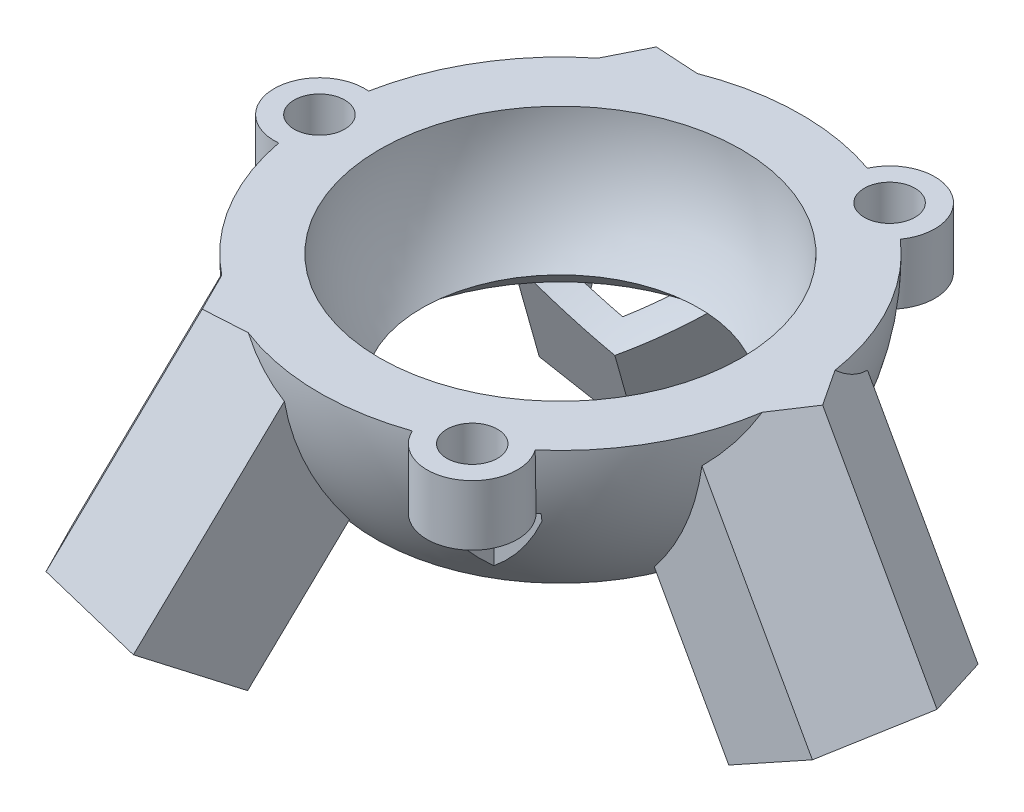
from build123d import *

# Parameters (mm, degrees)
IZIM4_R                          = 3.75
IZIM4_R_2                        = 1.75
Y_KSEKLIK_EKSTR_ZYON1_DEPTH      = 5
IZIM5_R                          = 2.1
KES_EKSTR_ZYON1_DEPTH            = 24
KES_EKSTR_ZYON2_DEPTH            = 36.170331308
Y_KSEKLIK_EKSTR_ZYON2_REACH      = 67.295
Y_KSEKLIK_EKSTR_ZYON2_END_RADIUS = 20
Y_KSEKLIK_EKSTR_ZYON2_START      = -5
DAIRESEL_KAPLAMA1_COUNT          = 3
KES_EKSTR_ZYON3_DEPTH            = 45
KES_EKSTR_ZYON3_DEPTH_BACK       = 39
IZIM10_W                         = 61.268894521
IZIM10_H                         = 17.891205564


with BuildPart() as part:
    # Çizim3 → Döndür1 (revolve)
    with BuildSketch(Plane.XY, mode=Mode.PRIVATE) as d_nd_r1_sk:
        with BuildLine():
            Line((-11.490666647, -9.641814145), (-15.320888862, -12.855752194))
            ThreePointArc((-15.320888862, -12.855752194), (-18.793852416, -6.840402867), (-20, 0))
            Line((-20, 0), (-15, 0))
            ThreePointArc((-15, 0), (-14.095389312, -5.13030215), (-11.490666647, -9.641814145))
        make_face()
    revolve(d_nd_r1_sk.sketch.rotate(Axis((0, 24.311963794, 0), (0, -1, 0)), 270), axis=Axis((0, 24.311963794, 0), (0, -1, 0)))

    # Çizim4 → Yükseklik-Ekstrüzyon1 (add)
    # profile 1 of 3: a face of its own
    with BuildSketch(Plane(origin=(0, 0, 0), x_dir=(1, 0, 0), z_dir=(0, 1, 0))):
        with Locations((10, 17.320508076)):
            Circle(IZIM4_R)
        with Locations((10, 17.320508076)):
            Circle(IZIM4_R_2, mode=Mode.SUBTRACT)
    # profile 2 of 3: a face of its own
    with BuildSketch(Plane(origin=(0, 0, 0), x_dir=(1, 0, 0), z_dir=(0, 1, 0))):
        with Locations((-20, 0)):
            Circle(IZIM4_R)
        with Locations((-20, 0)):
            Circle(IZIM4_R_2, mode=Mode.SUBTRACT)
    # profile 3 of 3: a face of its own
    with BuildSketch(Plane(origin=(0, 0, 0), x_dir=(1, 0, 0), z_dir=(0, 1, 0))):
        with Locations((10, -17.320508076)):
            Circle(IZIM4_R)
        with Locations((10, -17.320508076)):
            Circle(IZIM4_R_2, mode=Mode.SUBTRACT)
    extrude(amount=-Y_KSEKLIK_EKSTR_ZYON1_DEPTH)

    # Çizim5 → Kes-Ekstrüzyon1 (cut)
    with BuildSketch(Plane(origin=(0, 0, 0), x_dir=(1, 0, 0), z_dir=(0, 1, 0))):
        with Locations(Location((10, 17.320508076, 0), (0, 0, 270))):
            Circle(IZIM5_R)
        with Locations(Location((-20, 0, 0), (0, 0, 270))):
            Circle(IZIM5_R)
        with Locations(Location((10, -17.320508076, 0), (0, 0, 270))):
            Circle(IZIM5_R)
    extrude(amount=-KES_EKSTR_ZYON1_DEPTH, mode=Mode.SUBTRACT)

    # Çizim6 → Kes-Ekstrüzyon2 (cut)
    with BuildSketch(Plane(origin=(0, -41.170331308, 0), x_dir=(1, 0, 0), z_dir=(0, 1, 0))):
        Polygon((-16, 0), (-18, 3.464101615), (-22, 3.464101615), (-24, 0), (-22, -3.464101615), (-18, -3.464101615), align=None)
        Polygon((8.769230769, 14.300522052), (12.769230769, 14.300522052), (14.769230769, 17.764623667), (12.769230769, 21.228725283), (8.769230769, 21.228725283), (6.769230769, 17.764623667), align=None)
        Polygon((8.769230769, -14.300522052), (6.769230769, -17.764623667), (8.769230769, -21.228725283), (12.769230769, -21.228725283), (14.769230769, -17.764623667), (12.769230769, -14.300522052), align=None)
    extrude(amount=KES_EKSTR_ZYON2_DEPTH, mode=Mode.SUBTRACT)

    # Yükseklik-Ekstrüzyon2: up to this sphere (the profile starts outside it)
    y_kseklik_ekstr_zyon2_end = Location((0, 0, 0)) * Sphere(Y_KSEKLIK_EKSTR_ZYON2_END_RADIUS, mode=Mode.PRIVATE)
    # Çizim9 → Yükseklik-Ekstrüzyon2 (add, up to the surface)
    with BuildSketch(Plane(origin=(26.738833579, -25.345051489, 0), x_dir=(-0.8746197071393953, -0.48480962024633817, 0), z_dir=(0.48480962024633817, -0.8746197071393953, 0)).offset(Y_KSEKLIK_EKSTR_ZYON2_START), mode=Mode.PRIVATE) as y_kseklik_ekstr_zyon2_sk1:
        Polygon((3.967200538, 6.871392896), (-3.967200538, 6.871392896), (-7.934401077, 0), (-3.967200538, -6.871392896), (3.967200538, -6.871392896), (7.934401077, 0), align=None)
        Polygon((5.625, 0), (2.8125, 4.871392896), (-2.8125, 4.871392896), (-5.625, 0), (-2.8125, -4.871392896), (2.8125, -4.871392896), align=None, mode=Mode.SUBTRACT)
    y_kseklik_ekstr_zyon2_tool1 = extrude(y_kseklik_ekstr_zyon2_sk1.sketch, amount=-Y_KSEKLIK_EKSTR_ZYON2_REACH, mode=Mode.PRIVATE) - y_kseklik_ekstr_zyon2_end
    y_kseklik_ekstr_zyon2 = y_kseklik_ekstr_zyon2_tool1.solids().sort_by_distance((24.314785, -20.971953, -6.661468))[0]
    add(y_kseklik_ekstr_zyon2)

    # Dairesel Kaplama1: Yükseklik-Ekstrüzyon2 ×3 about axis
    dairesel_kaplama1_axis = Axis((0, 0, 0), (0, 1, 0))
    for i in range(1, DAIRESEL_KAPLAMA1_COUNT):
        add(y_kseklik_ekstr_zyon2.rotate(dairesel_kaplama1_axis, i * 360 / DAIRESEL_KAPLAMA1_COUNT))

    # Çizim10 → Kes-Ekstrüzyon3 (cut, two sides: drawn at the far end of the back side and taken through both)
    with BuildSketch(Plane.XY.offset(-KES_EKSTR_ZYON3_DEPTH_BACK)):
        with Locations((5.148097131, 8.945602782)):
            Rectangle(IZIM10_W, IZIM10_H)
    extrude(amount=KES_EKSTR_ZYON3_DEPTH + KES_EKSTR_ZYON3_DEPTH_BACK, mode=Mode.SUBTRACT)


solid = part.part
